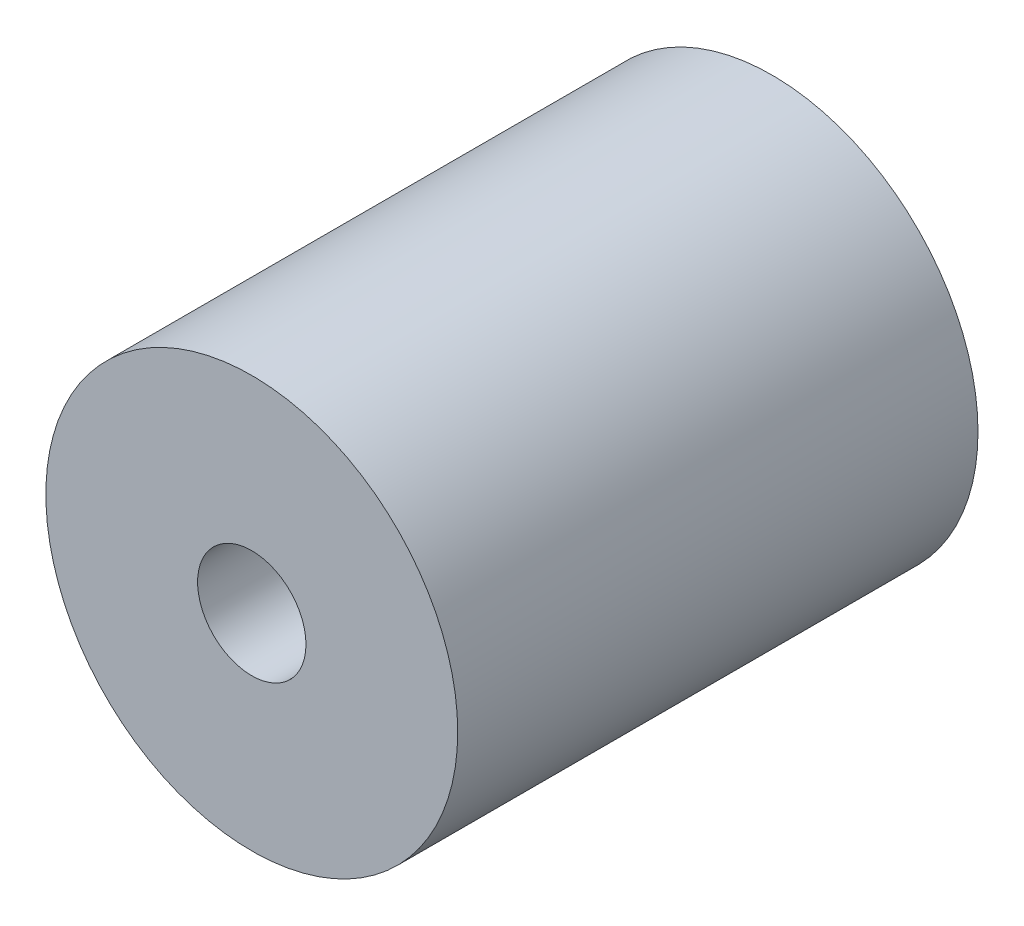
from build123d import *

# Parameters (mm, degrees)
SKETCH_1_R      = 9.5
SKETCH_1_R_2    = 4
EXTRUDE_1_DEPTH = 24
EXTRUDE_START   = -12
SKETCH_2_R      = 4
SKETCH_2_R_2    = 2.5
EXTRUDE_2_DEPTH = 12


with BuildPart() as part:
    # 草圖1 → 填料-伸長1 (new body)
    with BuildSketch(Plane.XY):
        Circle(SKETCH_1_R)
        Circle(SKETCH_1_R_2, mode=Mode.SUBTRACT)
    extrude(amount=EXTRUDE_1_DEPTH)

    # 草圖2 → 填料-伸長2 (add)
    with BuildSketch(Plane.XY.offset(24).offset(EXTRUDE_START)):
        Circle(SKETCH_2_R)
        Circle(SKETCH_2_R_2, mode=Mode.SUBTRACT)
    extrude(amount=EXTRUDE_2_DEPTH)


solid = part.part
